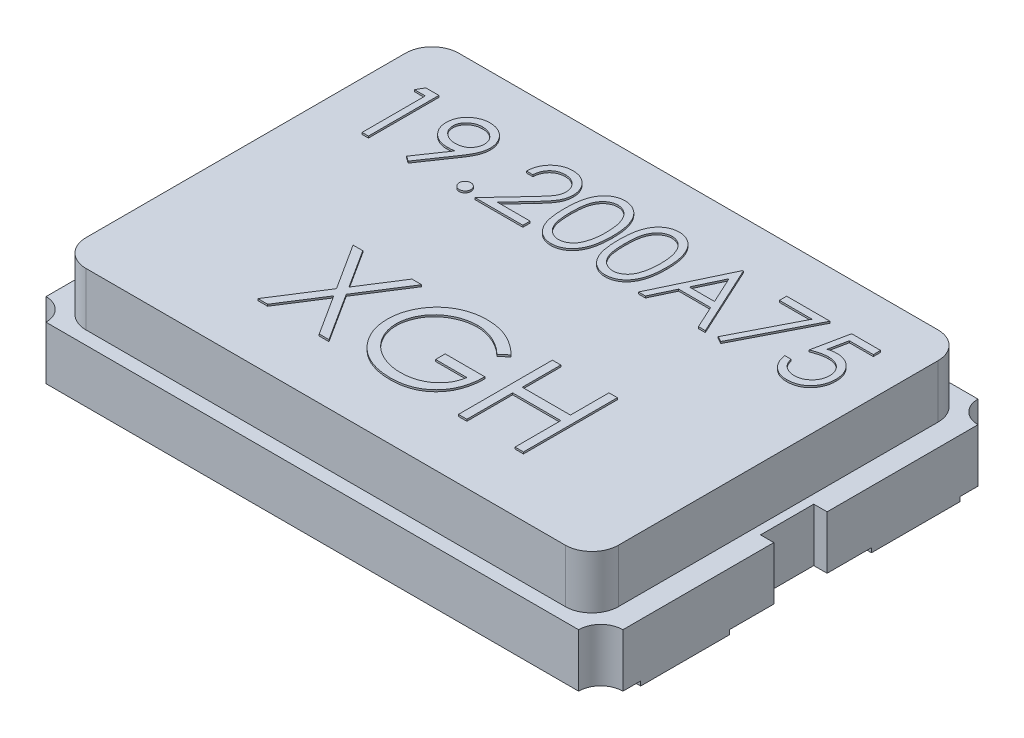
from build123d import *

# Parameters (mm, degrees)
EXTRUDE1_DEPTH = 0.6
EXTRUDE2_DEPTH = 0.6
SKETCH3_W      = 1
SKETCH3_H      = 1
EXTRUDE3_DEPTH = 0.05
EXTRUDE4_DEPTH = 0.02
EXTRUDE5_DEPTH = 0.02


with BuildPart() as part:
    # Sketch1 → Extrude1 (new body)
    with BuildSketch(Plane(origin=(0, 0, 0), x_dir=(1, 0, 0), z_dir=(0, 1, 0))):
        with BuildLine():
            Line((-3.25, 2), (-3.25, 0.3))
            Line((-3.25, 0.3), (-3.1, 0.3))
            Line((-3.1, 0.3), (-3.1, -0.3))
            Line((-3.1, -0.3), (-3.25, -0.3))
            Line((-3.25, -0.3), (-3.25, -2))
            ThreePointArc((-3.25, -2), (-3.073223305, -2.073223305), (-3, -2.25))
            Line((-3, -2.25), (3, -2.25))
            ThreePointArc((3, -2.25), (3.073223305, -2.073223305), (3.25, -2))
            Line((3.25, -2), (3.25, -0.3))
            Line((3.25, -0.3), (3.1, -0.3))
            Line((3.1, -0.3), (3.1, 0.3))
            Line((3.1, 0.3), (3.25, 0.3))
            Line((3.25, 0.3), (3.25, 2))
            ThreePointArc((3.25, 2), (3.073223305, 2.073223305), (3, 2.25))
            Line((3, 2.25), (-3, 2.25))
            ThreePointArc((-3, 2.25), (-3.073223305, 2.073223305), (-3.25, 2))
        make_face()
    extrude(amount=EXTRUDE1_DEPTH)

    # Sketch2 → Extrude2 (add)
    with BuildSketch(Plane(origin=(0, 0.6, 0), x_dir=(1, 0, 0), z_dir=(0, 1, 0))):
        with BuildLine():
            Line((-2.7, 2.1), (2.7, 2.1))
            ThreePointArc((2.7, 2.1), (2.912132034, 2.012132034), (3, 1.8))
            Line((3, 1.8), (3, -1.8))
            ThreePointArc((3, -1.8), (2.912132034, -2.012132034), (2.7, -2.1))
            Line((2.7, -2.1), (-2.7, -2.1))
            ThreePointArc((-2.7, -2.1), (-2.912132034, -2.012132034), (-3, -1.8))
            Line((-3, -1.8), (-3, 1.8))
            ThreePointArc((-3, 1.8), (-2.912132034, 2.012132034), (-2.7, 2.1))
        make_face()
    extrude(amount=EXTRUDE2_DEPTH)

    # Sketch3 → Extrude3 (add)
    with BuildSketch(Plane.XZ):
        with Locations((-2.75, 1.3)):
            Rectangle(SKETCH3_W, SKETCH3_H)
        with Locations((-2.75, -1.3)):
            Rectangle(SKETCH3_W, SKETCH3_H)
        with Locations((2.75, 1.3)):
            Rectangle(SKETCH3_W, SKETCH3_H)
        with Locations((2.75, -1.3)):
            Rectangle(SKETCH3_W, SKETCH3_H)
    extrude(amount=EXTRUDE3_DEPTH)

    # Sketch4 → Extrude4 (add)
    # profile 1 of 9: a face of its own
    with BuildSketch(Plane(origin=(0, 1.2, 0), x_dir=(1, 0, 0), z_dir=(0, 1, 0))):
        Polygon((-2.526616546, 1.555911653), (-2.379855478, 1.555911653), (-2.379855478, 0.762161653), (-2.451089453, 0.762161653), (-2.451089453, 1.474501397), (-2.573204837, 1.474501397), align=None)
    # profile 2 of 9: a face of its own
    with BuildSketch(Plane(origin=(0, 1.2, 0), x_dir=(1, 0, 0), z_dir=(0, 1, 0))):
        with BuildLine():
            Line((-1.911746504, 0.741809089), (-1.968670082, 0.781401186))
            Line((-1.968670082, 0.781401186), (-1.747971965, 1.104021128))
            add(Edge.make_bspline(
                [(-1.747971965, 1.104021128), (-1.762053257, 1.10229913), (-1.789780105, 1.098908419), (-1.817705841, 1.098285517), (-1.831449279, 1.097978961)],
                knots=[0, 0, 0, 0, 1.015715272, 2, 2, 2, 2], degree=3))
            add(Edge.make_bspline(
                [(-1.831449279, 1.097978961), (-1.83978185, 1.098192384), (-1.856137959, 1.098611314), (-1.880184423, 1.101931867), (-1.903290613, 1.107045914), (-1.925395271, 1.11467697), (-1.94658148, 1.124160743), (-1.96680299, 1.135921173), (-1.986032579, 1.149756528), (-2.004063724, 1.165593653), (-2.020462993, 1.18298314), (-2.035073277, 1.20138808), (-2.047215641, 1.221022274), (-2.057302295, 1.241485199), (-2.06495188, 1.263070969), (-2.070522313, 1.285533958), (-2.073951847, 1.309031598), (-2.074359856, 1.32502569), (-2.074567017, 1.333146479)],
                knots=[0, 0, 0, 0, 1.060718605, 2.082097864, 3.085795603, 4.069760067, 5.054557537, 6.03741023, 7.043284206, 8.066802108, 9.088538119, 10.083643548, 11.053783639, 12.022749082, 12.983451788, 13.964007469, 14.966251758, 16, 16, 16, 16], degree=3))
            add(Edge.make_bspline(
                [(-2.074567017, 1.333146479), (-2.074173672, 1.34425187), (-2.073401615, 1.366049499), (-2.067188023, 1.397897872), (-2.056968982, 1.428011963), (-2.042720404, 1.456312596), (-2.024773779, 1.482392668), (-2.00320451, 1.50588962), (-1.978143789, 1.526469256), (-1.95016251, 1.544159467), (-1.91991995, 1.558386868), (-1.888245093, 1.568873281), (-1.855380641, 1.575041568), (-1.833117616, 1.57585479), (-1.821909014, 1.576264217)],
                knots=[0, 0, 0, 0, 1.022988612, 2.007919123, 2.978103895, 3.94594894, 4.918897164, 5.887013414, 6.875921846, 7.89917871, 8.930658928, 9.948724884, 10.967259574, 12, 12, 12, 12], degree=3))
            add(Edge.make_bspline(
                [(-1.821909014, 1.576264217), (-1.810912533, 1.575849163), (-1.789184524, 1.575029053), (-1.75723291, 1.569022867), (-1.726630215, 1.558899908), (-1.697546084, 1.54491073), (-1.670617681, 1.527375453), (-1.646402453, 1.506480659), (-1.625453, 1.482213334), (-1.607803656, 1.455160408), (-1.593636343, 1.426093968), (-1.583414593, 1.395753686), (-1.577122279, 1.364357761), (-1.576329362, 1.343086515), (-1.575929196, 1.332351457)],
                knots=[0, 0, 0, 0, 1.026385292, 2.028040595, 3.023318987, 4.028184125, 5.03290303, 6.015178782, 7.004435299, 8.016004309, 9.023023918, 10.015172535, 10.998308025, 12, 12, 12, 12], degree=3))
            add(Edge.make_bspline(
                [(-1.575929196, 1.332351457), (-1.576196443, 1.324018495), (-1.576738485, 1.307117167), (-1.58053404, 1.281438143), (-1.586979332, 1.255255454), (-1.594293557, 1.233093592), (-1.601353888, 1.214790068), (-1.607998966, 1.200332121), (-1.615372258, 1.185114513), (-1.623971692, 1.169296813), (-1.633215999, 1.152677381), (-1.643661585, 1.135422908), (-1.65507017, 1.11751024), (-1.663195838, 1.105434561), (-1.66735673, 1.099250996)],
                knots=[0, 0, 0, 0, 1.179839688, 2.393009684, 3.667231171, 4.993948276, 5.694988576, 6.444077775, 7.246288328, 8.089075292, 8.993003841, 9.939041771, 10.944649915, 12, 12, 12, 12], degree=3))
            Line((-1.66735673, 1.099250996), (-1.911746504, 0.741809089))
        make_face()
        with BuildLine():
            add(Edge.make_bspline(
                [(-1.818251913, 1.179389217), (-1.811939556, 1.179561662), (-1.799651543, 1.179897352), (-1.781649906, 1.181940519), (-1.764658167, 1.185563191), (-1.748630937, 1.190761054), (-1.733407515, 1.197033192), (-1.719229705, 1.205018767), (-1.706085641, 1.21454754), (-1.693887308, 1.225254097), (-1.683055115, 1.23714914), (-1.673406963, 1.249599019), (-1.665206263, 1.262658386), (-1.65872852, 1.276490787), (-1.653402554, 1.290759511), (-1.64972454, 1.305694338), (-1.647687022, 1.321217457), (-1.647339683, 1.331762689), (-1.647163171, 1.337121589)],
                knots=[0, 0, 0, 0, 1.163407946, 2.26475976, 3.333800367, 4.359385343, 5.366239384, 6.363380779, 7.350133999, 8.353570782, 9.349036268, 10.310270964, 11.253520213, 12.184142, 13.120487599, 14.056272588, 15.012232024, 16, 16, 16, 16], degree=3))
            add(Edge.make_bspline(
                [(-1.647163171, 1.337121589), (-1.647315042, 1.342482727), (-1.647614323, 1.353047508), (-1.650015372, 1.36859361), (-1.654239306, 1.383491903), (-1.659906791, 1.397823951), (-1.667372631, 1.411471999), (-1.676331457, 1.424607399), (-1.686975066, 1.437146863), (-1.699222077, 1.448795481), (-1.712428841, 1.459533308), (-1.726503276, 1.469009793), (-1.741329373, 1.4769521), (-1.756816681, 1.483505974), (-1.772997467, 1.488620394), (-1.789862157, 1.492298261), (-1.807495973, 1.494332927), (-1.819466014, 1.494678071), (-1.825566116, 1.494853961)],
                knots=[0, 0, 0, 0, 0.972161553, 1.915763587, 2.844109794, 3.775983486, 4.705125789, 5.659731448, 6.655561913, 7.682237399, 8.721216875, 9.739758359, 10.754845918, 11.767244016, 12.7857855, 13.828538656, 14.893392813, 16, 16, 16, 16], degree=3))
            add(Edge.make_bspline(
                [(-1.825566116, 1.494853961), (-1.831613165, 1.494677787), (-1.843477425, 1.494332134), (-1.860954475, 1.492302129), (-1.877705133, 1.48859566), (-1.893839036, 1.483508343), (-1.909325884, 1.476951611), (-1.924151281, 1.469009377), (-1.938229008, 1.45953549), (-1.951423111, 1.448787032), (-1.963691747, 1.437201084), (-1.974152358, 1.424552467), (-1.983131687, 1.411478832), (-1.990587268, 1.397822135), (-1.996257482, 1.383492388), (-2.000480686, 1.368593479), (-2.002881931, 1.353047542), (-2.003181185, 1.342482739), (-2.003333043, 1.337121589)],
                knots=[0, 0, 0, 0, 1.099389452, 2.15699305, 3.192601482, 4.213358962, 5.227959689, 6.245255729, 7.266013209, 8.307253147, 9.336162325, 10.327954924, 11.284637477, 12.215801273, 13.149702402, 14.080068371, 15.025723358, 16, 16, 16, 16], degree=3))
            add(Edge.make_bspline(
                [(-2.003333043, 1.337121589), (-2.003195627, 1.331758515), (-2.002924619, 1.321181553), (-2.000310281, 1.305640746), (-1.995938242, 1.290743602), (-1.990082773, 1.27634527), (-1.982371699, 1.262585759), (-1.972909326, 1.249530304), (-1.961818247, 1.237030907), (-1.949246724, 1.225281772), (-1.935488051, 1.214497618), (-1.920793075, 1.20507912), (-1.905414773, 1.197125191), (-1.88929901, 1.190743127), (-1.872565218, 1.185615125), (-1.855063001, 1.181947196), (-1.83685024, 1.17991695), (-1.824510833, 1.179566816), (-1.818251913, 1.179389217)],
                knots=[0, 0, 0, 0, 0.952633368, 1.87876736, 2.791047057, 3.707742249, 4.635551637, 5.587206343, 6.568248508, 7.601284464, 8.641511608, 9.671105535, 10.699146789, 11.713763218, 12.747829548, 13.806491675, 14.887386225, 16, 16, 16, 16], degree=3))
        make_face(mode=Mode.SUBTRACT)
    # profile 3 of 9: a face of its own
    with BuildSketch(Plane(origin=(0, 1.2, 0), x_dir=(1, 0, 0), z_dir=(0, 1, 0))):
        with BuildLine():
            add(Edge.make_bspline(
                [(-1.34696285, 0.884277038), (-1.342542749, 0.884014382), (-1.333877656, 0.883499476), (-1.321350211, 0.879966909), (-1.310012136, 0.87369432), (-1.299912859, 0.865334369), (-1.291588355, 0.855198031), (-1.285092225, 0.843950387), (-1.28159043, 0.831318062), (-1.281079275, 0.822602761), (-1.280817017, 0.818131205)],
                knots=[0, 0, 0, 0, 1.020151414, 1.999887582, 2.974338812, 3.990962822, 5.007586832, 5.987933904, 6.967670073, 8, 8, 8, 8], degree=3))
            add(Edge.make_bspline(
                [(-1.280817017, 0.818131205), (-1.281088162, 0.813767092), (-1.281622856, 0.805161127), (-1.285084198, 0.792624081), (-1.291637863, 0.781369408), (-1.299855442, 0.77109553), (-1.310014633, 0.762717868), (-1.321377016, 0.756498646), (-1.333848248, 0.752713143), (-1.342537842, 0.752230929), (-1.34696285, 0.751985371)],
                knots=[0, 0, 0, 0, 1.009421747, 1.99056486, 2.972319754, 3.999869655, 5.017953583, 5.993804169, 6.978383603, 8, 8, 8, 8], degree=3))
            add(Edge.make_bspline(
                [(-1.34696285, 0.751985371), (-1.351391047, 0.752222044), (-1.360036046, 0.752684092), (-1.372460727, 0.756576371), (-1.383892307, 0.762659549), (-1.394049521, 0.771111151), (-1.402335924, 0.781316541), (-1.408600966, 0.792701591), (-1.412363375, 0.805125239), (-1.412858192, 0.813760024), (-1.413108684, 0.818131205)],
                knots=[0, 0, 0, 0, 1.022052826, 1.995314843, 2.982371812, 4.00089066, 5.028879526, 6.005146991, 6.990147033, 8, 8, 8, 8], degree=3))
            add(Edge.make_bspline(
                [(-1.413108684, 0.818131205), (-1.412867815, 0.822610082), (-1.412397548, 0.83135454), (-1.408593068, 0.843872909), (-1.402384534, 0.855250394), (-1.393992239, 0.865318904), (-1.383894765, 0.873752453), (-1.372488304, 0.879890362), (-1.360006122, 0.883528098), (-1.351386011, 0.884023062), (-1.34696285, 0.884277038)],
                knots=[0, 0, 0, 0, 1.032775665, 2.016367738, 2.991239715, 4.008302682, 5.025365648, 6.011011707, 6.979408107, 8, 8, 8, 8], degree=3))
        make_face()
    # profile 4 of 9: a face of its own
    with BuildSketch(Plane(origin=(0, 1.2, 0), x_dir=(1, 0, 0), z_dir=(0, 1, 0))):
        with BuildLine():
            Line((-1.077291376, 1.311680884), (-1.14852535, 1.311680884))
            add(Edge.make_bspline(
                [(-1.14852535, 1.311680884), (-1.148061085, 1.321131246), (-1.147149281, 1.339691506), (-1.142879294, 1.366752463), (-1.136769488, 1.392618462), (-1.12813089, 1.417081817), (-1.117402502, 1.440358833), (-1.104536943, 1.46235705), (-1.089298337, 1.482992552), (-1.072015739, 1.50207404), (-1.053244994, 1.519579078), (-1.032991682, 1.534695535), (-1.011708971, 1.547467578), (-0.989461429, 1.558144932), (-0.965998051, 1.566159504), (-0.94153176, 1.572106197), (-0.915955063, 1.575684047), (-0.898528843, 1.576068627), (-0.889666176, 1.576264217)],
                knots=[0, 0, 0, 0, 1.10065271, 2.161652631, 3.183658789, 4.190468796, 5.17591951, 6.163126047, 7.15150782, 8.156236427, 9.156009102, 10.134482811, 11.092018607, 12.041330605, 13.001268258, 13.972401359, 14.968799086, 16, 16, 16, 16], degree=3))
            add(Edge.make_bspline(
                [(-0.889666176, 1.576264217), (-0.880962577, 1.57606046), (-0.863860316, 1.575660085), (-0.838899823, 1.57222178), (-0.81513783, 1.566836619), (-0.792620782, 1.559281159), (-0.771528336, 1.54912469), (-0.751702038, 1.536924177), (-0.732905854, 1.522813608), (-0.715986101, 1.50620069), (-0.700449448, 1.488465506), (-0.687045901, 1.469531642), (-0.675567558, 1.449976072), (-0.665999995, 1.429649676), (-0.658956906, 1.408361068), (-0.653609706, 1.386420185), (-0.650587239, 1.363599915), (-0.650123366, 1.348154321), (-0.64988753, 1.340301677)],
                knots=[0, 0, 0, 0, 1.111607364, 2.184268762, 3.212621178, 4.221274766, 5.211760367, 6.196651075, 7.1921475, 8.207485113, 9.220403448, 10.201281604, 11.166441695, 12.114753415, 13.065576456, 14.026450734, 14.996634279, 16, 16, 16, 16], degree=3))
            add(Edge.make_bspline(
                [(-0.64988753, 1.340301677), (-0.650271538, 1.329246365), (-0.651032814, 1.307329745), (-0.657544825, 1.275122803), (-0.667715373, 1.243918581), (-0.679961202, 1.218804943), (-0.692314774, 1.198568061), (-0.70344712, 1.181906408), (-0.716479318, 1.163966418), (-0.731601049, 1.144808165), (-0.748499504, 1.124281585), (-0.767327744, 1.102399078), (-0.788220034, 1.07938673), (-0.802883658, 1.06366921), (-0.810481981, 1.055524784)],
                knots=[0, 0, 0, 0, 1.184426356, 2.348067706, 3.509069118, 4.696110526, 5.333549288, 6.050745305, 6.844228056, 7.710549037, 8.667450064, 9.695053472, 10.805634456, 12, 12, 12, 12], degree=3))
            Line((-0.810481981, 1.055524784), (-1.009078485, 0.84357191))
            Line((-1.009078485, 0.84357191), (-0.639711248, 0.84357191))
            Line((-0.639711248, 0.84357191), (-0.639711248, 0.762161653))
            Line((-0.639711248, 0.762161653), (-1.179054196, 0.762161653))
            Line((-1.179054196, 0.762161653), (-0.871221664, 1.090664758))
            add(Edge.make_bspline(
                [(-0.871221664, 1.090664758), (-0.863726876, 1.098488481), (-0.849330921, 1.113516252), (-0.828969515, 1.135456174), (-0.810681744, 1.155810087), (-0.794349228, 1.174539537), (-0.780326273, 1.191918481), (-0.767882034, 1.207384066), (-0.757911267, 1.221615879), (-0.747090096, 1.238112411), (-0.736609426, 1.258253776), (-0.727603231, 1.282867666), (-0.722111649, 1.308205811), (-0.721452874, 1.325328594), (-0.721121504, 1.333941501)],
                knots=[0, 0, 0, 0, 1.329631726, 2.553950428, 3.673215718, 4.687767853, 5.603093632, 6.413772471, 7.123043292, 7.734684054, 8.834405432, 9.900288307, 10.943827018, 12, 12, 12, 12], degree=3))
            add(Edge.make_bspline(
                [(-0.721121504, 1.333941501), (-0.721265681, 1.339357461), (-0.721549827, 1.350031278), (-0.724057555, 1.365680798), (-0.727847259, 1.380776747), (-0.733277701, 1.395365559), (-0.740445659, 1.409300555), (-0.749170872, 1.422598698), (-0.759237904, 1.435454946), (-0.770883638, 1.447509354), (-0.783676965, 1.458549556), (-0.797192089, 1.468329483), (-0.811490952, 1.476502638), (-0.826513266, 1.483202681), (-0.842217149, 1.488458527), (-0.858632975, 1.492100383), (-0.875715386, 1.494386946), (-0.887379768, 1.494696321), (-0.893323277, 1.494853961)],
                knots=[0, 0, 0, 0, 0.991446411, 1.95395049, 2.89581595, 3.838931463, 4.798493298, 5.75982156, 6.748411868, 7.785213223, 8.824556874, 9.840280684, 10.836137867, 11.835679398, 12.848801643, 13.863922112, 14.911575587, 16, 16, 16, 16], degree=3))
            add(Edge.make_bspline(
                [(-0.893323277, 1.494853961), (-0.899530591, 1.494691802), (-0.91172073, 1.494373348), (-0.92961844, 1.492145708), (-0.946692178, 1.488302634), (-0.962984896, 1.483046495), (-0.978524159, 1.476365717), (-0.993234397, 1.468044554), (-1.007082588, 1.458115083), (-1.020094764, 1.446857314), (-1.032083559, 1.434323411), (-1.042617047, 1.420351152), (-1.051820922, 1.405195649), (-1.05985123, 1.388897795), (-1.06637261, 1.371309706), (-1.071355807, 1.352493816), (-1.075298895, 1.332531824), (-1.076616185, 1.318746635), (-1.077291376, 1.311680884)],
                knots=[0, 0, 0, 0, 1.031018746, 2.02475058, 2.990194455, 3.934040569, 4.864654155, 5.795059489, 6.735614925, 7.690564532, 8.649604399, 9.611025574, 10.590972636, 11.591080095, 12.624614302, 13.701020113, 14.821632451, 16, 16, 16, 16], degree=3))
        make_face()
    # profile 5 of 9: a face of its own
    with BuildSketch(Plane(origin=(0, 1.2, 0), x_dir=(1, 0, 0), z_dir=(0, 1, 0))):
        with BuildLine():
            add(Edge.make_bspline(
                [(-0.568477273, 1.158718644), (-0.568402884, 1.171440731), (-0.56825838, 1.196153566), (-0.566650828, 1.232163655), (-0.563980348, 1.26594572), (-0.560320623, 1.29750138), (-0.555867009, 1.32683878), (-0.549921711, 1.35387952), (-0.543160594, 1.378748752), (-0.535324592, 1.401527574), (-0.526482719, 1.422522874), (-0.516859235, 1.442122875), (-0.506072219, 1.46029792), (-0.494738169, 1.477338098), (-0.482398288, 1.492964472), (-0.469403741, 1.507397718), (-0.455247352, 1.520304263), (-0.440410348, 1.532062264), (-0.4247584, 1.542369555), (-0.408737652, 1.551448408), (-0.392237834, 1.55920445), (-0.375213896, 1.565302816), (-0.357818851, 1.570339919), (-0.339991892, 1.573784555), (-0.321703582, 1.575951926), (-0.30935931, 1.576159133), (-0.303098918, 1.576264217)],
                knots=[0, 0, 0, 0, 1.646270934, 3.197905019, 4.663502075, 6.030701355, 7.308322542, 8.50163776, 9.611534131, 10.641858119, 11.616356847, 12.558055219, 13.465016945, 14.349605745, 15.204443733, 16.039544428, 16.859896111, 17.680448484, 18.487036065, 19.28249412, 20.06191084, 20.843045899, 21.620316918, 22.403196591, 23.190181807, 24, 24, 24, 24], degree=3))
            add(Edge.make_bspline(
                [(-0.303098918, 1.576264217), (-0.296786229, 1.576153588), (-0.284232277, 1.575933581), (-0.265672049, 1.573819044), (-0.247540603, 1.570310414), (-0.22991524, 1.56533905), (-0.21265118, 1.559171459), (-0.195883459, 1.551440988), (-0.179507925, 1.542442388), (-0.163784806, 1.531868758), (-0.148541492, 1.520079921), (-0.1341524, 1.506753387), (-0.120616221, 1.492023718), (-0.107763072, 1.47604851), (-0.095957606, 1.458521357), (-0.08471506, 1.439747103), (-0.074652116, 1.419397425), (-0.064960502, 1.397811855), (-0.056595061, 1.374393132), (-0.049050751, 1.349273267), (-0.042954985, 1.322155549), (-0.037877418, 1.293182258), (-0.033943844, 1.262246989), (-0.031078941, 1.229416057), (-0.02956558, 1.194667861), (-0.029280579, 1.170910278), (-0.029134325, 1.158718644)],
                knots=[0, 0, 0, 0, 0.810914788, 1.612654377, 2.396697861, 3.181598691, 3.963628158, 4.749916497, 5.551656086, 6.361998678, 7.18212741, 8.025565596, 8.878627764, 9.750805457, 10.657531673, 11.591944965, 12.560506719, 13.57287815, 14.630710178, 15.753379473, 16.941251878, 18.199788006, 19.531962791, 20.947069417, 22.433333509, 24, 24, 24, 24], degree=3))
            add(Edge.make_bspline(
                [(-0.029134325, 1.158718644), (-0.029282095, 1.146580187), (-0.029570019, 1.122928897), (-0.031061975, 1.088337051), (-0.034000808, 1.055680352), (-0.037677002, 1.024880479), (-0.042768559, 0.996065626), (-0.049029017, 0.969136081), (-0.055980072, 0.943975551), (-0.064560463, 0.920790156), (-0.07395182, 0.899256462), (-0.084169695, 0.879148019), (-0.095116602, 0.860287092), (-0.107042978, 0.84282465), (-0.119755092, 0.82663699), (-0.133525019, 0.81200985), (-0.147964598, 0.798590787), (-0.163252771, 0.78665015), (-0.179221105, 0.776198775), (-0.195540395, 0.766852063), (-0.212500198, 0.759315362), (-0.229716171, 0.752844022), (-0.247434569, 0.747899991), (-0.265633304, 0.744481456), (-0.284219807, 0.742083912), (-0.296784091, 0.741901014), (-0.303098918, 0.741809089)],
                knots=[0, 0, 0, 0, 1.561518951, 3.042555995, 4.452378317, 5.7783523, 7.031515105, 8.214008947, 9.334062868, 10.386615937, 11.391082383, 12.354592575, 13.286541444, 14.194233754, 15.072674879, 15.931287219, 16.775624067, 17.606195743, 18.42308326, 19.229000347, 20.022332153, 20.807536673, 21.593273796, 22.3848459, 23.188221202, 24, 24, 24, 24], degree=3))
            add(Edge.make_bspline(
                [(-0.303098918, 0.741809089), (-0.309359137, 0.741914852), (-0.321703066, 0.742123395), (-0.339993884, 0.744280974), (-0.357747224, 0.747749775), (-0.375050691, 0.752606755), (-0.391993062, 0.758551906), (-0.40834347, 0.766297473), (-0.424283712, 0.775217878), (-0.439771261, 0.78537684), (-0.454515091, 0.797015864), (-0.468598167, 0.809889194), (-0.481666698, 0.824318075), (-0.493830145, 0.840074675), (-0.50539034, 0.857014036), (-0.51602418, 0.875367434), (-0.52586007, 0.895062098), (-0.534850648, 0.916225267), (-0.542821862, 0.93916576), (-0.549863039, 0.96414602), (-0.5554225, 0.99138653), (-0.560181134, 1.020668504), (-0.564019343, 1.052117771), (-0.566639698, 1.085751402), (-0.568259247, 1.121548441), (-0.568403272, 1.146102479), (-0.568477273, 1.158718644)],
                knots=[0, 0, 0, 0, 0.810891512, 1.598919785, 2.382837074, 3.152667961, 3.926044502, 4.706494248, 5.493654104, 6.291793342, 7.103789334, 7.925228297, 8.761435821, 9.622817696, 10.50288917, 11.416980706, 12.369136599, 13.353924996, 14.394355917, 15.514179734, 16.714354668, 17.994756427, 19.357759367, 20.818452758, 22.365282078, 24, 24, 24, 24], degree=3))
        make_face()
        with BuildLine():
            add(Edge.make_bspline(
                [(-0.497243299, 1.159036653), (-0.49721621, 1.148434716), (-0.497163636, 1.127858438), (-0.495790176, 1.09795827), (-0.493919141, 1.070070356), (-0.491505847, 1.044159286), (-0.487921964, 1.020312766), (-0.483906318, 0.998366784), (-0.479019519, 0.978437482), (-0.473237613, 0.960388103), (-0.466651961, 0.943912333), (-0.459461524, 0.928581343), (-0.451737038, 0.914214029), (-0.44309216, 0.900939442), (-0.433677136, 0.888714294), (-0.423704629, 0.877322206), (-0.412802454, 0.86716289), (-0.397720355, 0.854978407), (-0.377809369, 0.842387461), (-0.35272223, 0.831423258), (-0.326943849, 0.824532951), (-0.309447048, 0.823656706), (-0.300713852, 0.823219346)],
                knots=[0, 0, 0, 0, 1.459021318, 2.831673884, 4.118529203, 5.306027144, 6.411944654, 7.436330062, 8.375795394, 9.233974572, 10.042671642, 10.816086306, 11.563610507, 12.285937304, 12.993564865, 13.685989202, 14.367179055, 15.041617293, 16.353048772, 17.594441528, 18.799311195, 20, 20, 20, 20], degree=3))
            add(Edge.make_bspline(
                [(-0.300713852, 0.823219346), (-0.291924166, 0.823581699), (-0.274362941, 0.824305659), (-0.248705812, 0.831290373), (-0.223797876, 0.841829), (-0.204277989, 0.85429031), (-0.189427484, 0.866157627), (-0.178787381, 0.876275592), (-0.169021523, 0.887604869), (-0.159759124, 0.899828459), (-0.151263941, 0.913179898), (-0.143538908, 0.927594982), (-0.136489649, 0.943113742), (-0.13247349, 0.953947236), (-0.130420132, 0.959486122)],
                knots=[0, 0, 0, 0, 1.353760809, 2.704726607, 4.075137775, 5.516104923, 6.260822281, 7.007110065, 7.778089737, 8.566572457, 9.372053459, 10.217411131, 11.088608312, 12, 12, 12, 12], degree=3))
            add(Edge.make_bspline(
                [(-0.130420132, 0.959486122), (-0.128027142, 0.966568581), (-0.123168345, 0.98094901), (-0.116906389, 1.003256481), (-0.111974844, 1.026661393), (-0.107538152, 1.051023875), (-0.104509869, 1.076523593), (-0.102072419, 1.103081648), (-0.100636709, 1.130718064), (-0.100458739, 1.149494785), (-0.100368299, 1.159036653)],
                knots=[0, 0, 0, 0, 0.884706709, 1.796334032, 2.740027952, 3.714592787, 4.726048262, 5.777819803, 6.87074269, 8, 8, 8, 8], degree=3))
            add(Edge.make_bspline(
                [(-0.100368299, 1.159036653), (-0.100493074, 1.168576978), (-0.100737161, 1.187239892), (-0.101670154, 1.214571694), (-0.104079429, 1.240531346), (-0.106755301, 1.265230686), (-0.110700742, 1.288532987), (-0.114954745, 1.310633324), (-0.12067002, 1.331257903), (-0.12677504, 1.350729629), (-0.133762398, 1.368827278), (-0.141454002, 1.385635226), (-0.149668579, 1.401234618), (-0.158590837, 1.415582657), (-0.168114858, 1.428743609), (-0.178492017, 1.440453597), (-0.189310687, 1.451075552), (-0.20446387, 1.463200099), (-0.224301789, 1.475562573), (-0.248986427, 1.486939451), (-0.274674591, 1.49347276), (-0.292040357, 1.494393893), (-0.300713852, 1.494853961)],
                knots=[0, 0, 0, 0, 1.31362396, 2.569729283, 3.763502607, 4.902122613, 5.988968491, 7.01645872, 7.998833611, 8.933434873, 9.825090667, 10.667526885, 11.477055099, 12.250526234, 12.991942729, 13.710640831, 14.402115721, 15.076753259, 16.378508321, 17.609869233, 18.806226677, 20, 20, 20, 20], degree=3))
            add(Edge.make_bspline(
                [(-0.300713852, 1.494853961), (-0.309492861, 1.494393258), (-0.327066873, 1.493471012), (-0.353022034, 1.486963792), (-0.377901414, 1.475621566), (-0.397686874, 1.463159153), (-0.412850626, 1.451289572), (-0.423528308, 1.440996572), (-0.433540029, 1.429737511), (-0.442762883, 1.417399934), (-0.451400988, 1.404140824), (-0.459334182, 1.389855872), (-0.466481862, 1.374472688), (-0.473077819, 1.358004317), (-0.478877362, 1.339956496), (-0.483661172, 1.320051742), (-0.488080557, 1.298175563), (-0.491209127, 1.274199889), (-0.493990372, 1.248282329), (-0.495777749, 1.220324795), (-0.49716823, 1.19037448), (-0.497217775, 1.169691813), (-0.497243299, 1.159036653)],
                knots=[0, 0, 0, 0, 1.207732386, 2.417664972, 3.655092373, 4.956220595, 5.625982001, 6.301752483, 6.994047911, 7.697131622, 8.419323945, 9.170223765, 9.943494443, 10.752040957, 11.610060368, 12.549350801, 13.567764191, 14.679664412, 15.874934091, 17.154273443, 18.533957287, 20, 20, 20, 20], degree=3))
        make_face(mode=Mode.SUBTRACT)
    # profile 6 of 9: a face of its own
    with BuildSketch(Plane(origin=(0, 1.2, 0), x_dir=(1, 0, 0), z_dir=(0, 1, 0))):
        with BuildLine():
            add(Edge.make_bspline(
                [(0.04209965, 1.158718644), (0.04217404, 1.171440731), (0.042318543, 1.196153566), (0.043926095, 1.232163655), (0.046596575, 1.26594572), (0.050256301, 1.29750138), (0.054709914, 1.32683878), (0.060655212, 1.35387952), (0.067416329, 1.378748752), (0.075252331, 1.401527574), (0.084094204, 1.422522874), (0.093717688, 1.442122875), (0.104504704, 1.46029792), (0.115838754, 1.477338098), (0.128178635, 1.492964472), (0.141173182, 1.507397718), (0.155329572, 1.520304263), (0.170166575, 1.532062264), (0.185818523, 1.542369555), (0.201839271, 1.551448408), (0.21833909, 1.55920445), (0.235363027, 1.565302816), (0.252758072, 1.570339919), (0.270585032, 1.573784555), (0.288873341, 1.575951926), (0.301217613, 1.576159133), (0.307478005, 1.576264217)],
                knots=[0, 0, 0, 0, 1.646270934, 3.197905019, 4.663502075, 6.030701355, 7.308322542, 8.50163776, 9.611534131, 10.641858119, 11.616356847, 12.558055219, 13.465016945, 14.349605745, 15.204443733, 16.039544428, 16.859896111, 17.680448484, 18.487036065, 19.28249412, 20.06191084, 20.843045899, 21.620316918, 22.403196591, 23.190181807, 24, 24, 24, 24], degree=3))
            add(Edge.make_bspline(
                [(0.307478005, 1.576264217), (0.313790694, 1.576153588), (0.326344646, 1.575933581), (0.344904874, 1.573819044), (0.36303632, 1.570310414), (0.380661683, 1.56533905), (0.397925743, 1.559171459), (0.414693464, 1.551440988), (0.431068998, 1.542442388), (0.446792117, 1.531868758), (0.462035432, 1.520079921), (0.476424523, 1.506753387), (0.489960702, 1.492023718), (0.502813851, 1.47604851), (0.514619317, 1.458521357), (0.525861863, 1.439747103), (0.535924807, 1.419397425), (0.545616421, 1.397811855), (0.553981863, 1.374393132), (0.561526172, 1.349273267), (0.567621938, 1.322155549), (0.572699505, 1.293182258), (0.57663308, 1.262246989), (0.579497982, 1.229416057), (0.581011343, 1.194667861), (0.581296345, 1.170910278), (0.581442598, 1.158718644)],
                knots=[0, 0, 0, 0, 0.810914788, 1.612654377, 2.396697861, 3.181598691, 3.963628158, 4.749916497, 5.551656086, 6.361998678, 7.18212741, 8.025565596, 8.878627764, 9.750805457, 10.657531673, 11.591944965, 12.560506719, 13.57287815, 14.630710178, 15.753379473, 16.941251878, 18.199788006, 19.531962791, 20.947069417, 22.433333509, 24, 24, 24, 24], degree=3))
            add(Edge.make_bspline(
                [(0.581442598, 1.158718644), (0.581294828, 1.146580187), (0.581006904, 1.122928897), (0.579514948, 1.088337051), (0.576576115, 1.055680352), (0.572899922, 1.024880479), (0.567808364, 0.996065626), (0.561547906, 0.969136081), (0.554596851, 0.943975551), (0.54601646, 0.920790156), (0.536625103, 0.899256462), (0.526407228, 0.879148019), (0.515460321, 0.860287092), (0.503533945, 0.84282465), (0.490821832, 0.82663699), (0.477051904, 0.81200985), (0.462612325, 0.798590787), (0.447324152, 0.78665015), (0.431355818, 0.776198775), (0.415036528, 0.766852063), (0.398076725, 0.759315362), (0.380860752, 0.752844022), (0.363142354, 0.747899991), (0.344943619, 0.744481456), (0.326357116, 0.742083912), (0.313792832, 0.741901014), (0.307478005, 0.741809089)],
                knots=[0, 0, 0, 0, 1.561518951, 3.042555995, 4.452378317, 5.7783523, 7.031515105, 8.214008947, 9.334062868, 10.386615937, 11.391082383, 12.354592575, 13.286541444, 14.194233754, 15.072674879, 15.931287219, 16.775624067, 17.606195743, 18.42308326, 19.229000347, 20.022332153, 20.807536673, 21.593273796, 22.3848459, 23.188221202, 24, 24, 24, 24], degree=3))
            add(Edge.make_bspline(
                [(0.307478005, 0.741809089), (0.301217786, 0.741914852), (0.288873857, 0.742123395), (0.270583039, 0.744280974), (0.252829699, 0.747749775), (0.235526232, 0.752606755), (0.218583861, 0.758551906), (0.202233454, 0.766297473), (0.186293211, 0.775217878), (0.170805662, 0.78537684), (0.156061832, 0.797015864), (0.141978756, 0.809889194), (0.128910225, 0.824318075), (0.116746778, 0.840074675), (0.105186583, 0.857014036), (0.094552743, 0.875367434), (0.084716853, 0.895062098), (0.075726275, 0.916225267), (0.067755061, 0.93916576), (0.060713884, 0.96414602), (0.055154423, 0.99138653), (0.050395789, 1.020668504), (0.046557581, 1.052117771), (0.043937225, 1.085751402), (0.042317676, 1.121548441), (0.042173651, 1.146102479), (0.04209965, 1.158718644)],
                knots=[0, 0, 0, 0, 0.810891512, 1.598919785, 2.382837074, 3.152667961, 3.926044502, 4.706494248, 5.493654104, 6.291793342, 7.103789334, 7.925228297, 8.761435821, 9.622817696, 10.50288917, 11.416980706, 12.369136599, 13.353924996, 14.394355917, 15.514179734, 16.714354668, 17.994756427, 19.357759367, 20.818452758, 22.365282078, 24, 24, 24, 24], degree=3))
        make_face()
        with BuildLine():
            add(Edge.make_bspline(
                [(0.113333624, 1.159036653), (0.113360713, 1.148434716), (0.113413287, 1.127858438), (0.114786747, 1.09795827), (0.116657782, 1.070070356), (0.119071076, 1.044159286), (0.122654959, 1.020312766), (0.126670605, 0.998366784), (0.131557404, 0.978437482), (0.13733931, 0.960388103), (0.143924962, 0.943912333), (0.151115399, 0.928581343), (0.158839885, 0.914214029), (0.167484764, 0.900939442), (0.176899787, 0.888714294), (0.186872294, 0.877322206), (0.197774469, 0.86716289), (0.212856568, 0.854978407), (0.232767554, 0.842387461), (0.257854693, 0.831423258), (0.283633074, 0.824532951), (0.301129875, 0.823656706), (0.309863071, 0.823219346)],
                knots=[0, 0, 0, 0, 1.459021318, 2.831673884, 4.118529203, 5.306027144, 6.411944654, 7.436330062, 8.375795394, 9.233974572, 10.042671642, 10.816086306, 11.563610507, 12.285937304, 12.993564865, 13.685989202, 14.367179055, 15.041617293, 16.353048772, 17.594441528, 18.799311195, 20, 20, 20, 20], degree=3))
            add(Edge.make_bspline(
                [(0.309863071, 0.823219346), (0.318652757, 0.823581699), (0.336213983, 0.824305659), (0.361871111, 0.831290373), (0.386779047, 0.841829), (0.406298934, 0.85429031), (0.421149439, 0.866157627), (0.431789542, 0.876275592), (0.4415554, 0.887604869), (0.450817799, 0.899828459), (0.459312982, 0.913179898), (0.467038015, 0.927594982), (0.474087274, 0.943113742), (0.478103433, 0.953947236), (0.480156791, 0.959486122)],
                knots=[0, 0, 0, 0, 1.353760809, 2.704726607, 4.075137775, 5.516104923, 6.260822281, 7.007110065, 7.778089737, 8.566572457, 9.372053459, 10.217411131, 11.088608312, 12, 12, 12, 12], degree=3))
            add(Edge.make_bspline(
                [(0.480156791, 0.959486122), (0.482549781, 0.966568581), (0.487408578, 0.98094901), (0.493670534, 1.003256481), (0.49860208, 1.026661393), (0.503038771, 1.051023875), (0.506067054, 1.076523593), (0.508504504, 1.103081648), (0.509940214, 1.130718064), (0.510118184, 1.149494785), (0.510208624, 1.159036653)],
                knots=[0, 0, 0, 0, 0.884706709, 1.796334032, 2.740027952, 3.714592787, 4.726048262, 5.777819803, 6.87074269, 8, 8, 8, 8], degree=3))
            add(Edge.make_bspline(
                [(0.510208624, 1.159036653), (0.510083849, 1.168576978), (0.509839762, 1.187239892), (0.508906769, 1.214571694), (0.506497494, 1.240531346), (0.503821622, 1.265230686), (0.499876181, 1.288532987), (0.495622178, 1.310633324), (0.489906903, 1.331257903), (0.483801883, 1.350729629), (0.476814525, 1.368827278), (0.469122921, 1.385635226), (0.460908344, 1.401234618), (0.451986086, 1.415582657), (0.442462065, 1.428743609), (0.432084906, 1.440453597), (0.421266236, 1.451075552), (0.406113053, 1.463200099), (0.386275134, 1.475562573), (0.361590496, 1.486939451), (0.335902332, 1.49347276), (0.318536566, 1.494393893), (0.309863071, 1.494853961)],
                knots=[0, 0, 0, 0, 1.31362396, 2.569729283, 3.763502607, 4.902122613, 5.988968491, 7.01645872, 7.998833611, 8.933434873, 9.825090667, 10.667526885, 11.477055099, 12.250526234, 12.991942729, 13.710640831, 14.402115721, 15.076753259, 16.378508321, 17.609869233, 18.806226677, 20, 20, 20, 20], degree=3))
            add(Edge.make_bspline(
                [(0.309863071, 1.494853961), (0.301084062, 1.494393258), (0.28351005, 1.493471012), (0.257554889, 1.486963792), (0.232675509, 1.475621566), (0.212890049, 1.463159153), (0.197726297, 1.451289572), (0.187048615, 1.440996572), (0.177036894, 1.429737511), (0.16781404, 1.417399934), (0.159175935, 1.404140824), (0.151242741, 1.389855872), (0.144095061, 1.374472688), (0.137499104, 1.358004317), (0.131699561, 1.339956496), (0.126915751, 1.320051742), (0.122496366, 1.298175563), (0.119367796, 1.274199889), (0.116586551, 1.248282329), (0.114799174, 1.220324795), (0.113408693, 1.19037448), (0.113359148, 1.169691813), (0.113333624, 1.159036653)],
                knots=[0, 0, 0, 0, 1.207732386, 2.417664972, 3.655092373, 4.956220595, 5.625982001, 6.301752483, 6.994047911, 7.697131622, 8.419323945, 9.170223765, 9.943494443, 10.752040957, 11.610060368, 12.549350801, 13.567764191, 14.679664412, 15.874934091, 17.154273443, 18.533957287, 20, 20, 20, 20], degree=3))
        make_face(mode=Mode.SUBTRACT)
    # profile 7 of 9: a face of its own
    with BuildSketch(Plane(origin=(0, 1.2, 0), x_dir=(1, 0, 0), z_dir=(0, 1, 0))):
        Polygon((1.049551573, 1.555911653), (1.415897727, 0.762161653), (1.33846258, 0.762161653), (1.221117328, 1.016568705), (0.861290355, 1.016568705), (0.74060601, 0.762161653), (0.662852855, 0.762161653), (1.039375291, 1.555911653), align=None)
        Polygon((1.04366841, 1.401200365), (0.899928426, 1.097978961), (1.183592288, 1.097978961), align=None, mode=Mode.SUBTRACT)
    # profile 8 of 9: a face of its own
    with BuildSketch(Plane(origin=(0, 1.2, 0), x_dir=(1, 0, 0), z_dir=(0, 1, 0))):
        Polygon((1.538013111, 1.555911653), (2.02647465, 1.555911653), (1.609247086, 0.741809089), (1.54771238, 0.775677028), (1.905949309, 1.474501397), (1.538013111, 1.474501397), align=None)
    # profile 9 of 9: a face of its own
    with BuildSketch(Plane(origin=(0, 1.2, 0), x_dir=(1, 0, 0), z_dir=(0, 1, 0))):
        with BuildLine():
            Line((2.596346445, 1.555911653), (2.596346445, 1.474501397))
            Line((2.596346445, 1.474501397), (2.326356961, 1.474501397))
            Line((2.326356961, 1.474501397), (2.283584776, 1.26572861))
            add(Edge.make_bspline(
                [(2.283584776, 1.26572861), (2.291988519, 1.26804869), (2.308269442, 1.272543477), (2.332299624, 1.277534071), (2.355112499, 1.280542485), (2.369916021, 1.280953264), (2.377079367, 1.281152038)],
                knots=[0, 0, 0, 0, 1.100273476, 2.13160584, 3.095893838, 4, 4, 4, 4], degree=3))
            add(Edge.make_bspline(
                [(2.377079367, 1.281152038), (2.385943001, 1.280960192), (2.40337112, 1.280582974), (2.428870667, 1.276960787), (2.453212234, 1.271259414), (2.476344914, 1.263294581), (2.498311503, 1.253109695), (2.518909896, 1.24038703), (2.53844928, 1.225525007), (2.556579119, 1.208437834), (2.573026596, 1.189632396), (2.587487811, 1.169412665), (2.599771113, 1.147975141), (2.60965007, 1.125115003), (2.61753866, 1.101084981), (2.622789202, 1.075632235), (2.626285491, 1.048996679), (2.626676104, 1.03078475), (2.626875291, 1.021497841)],
                knots=[0, 0, 0, 0, 1.052922333, 2.070308379, 3.05430497, 4.020497103, 4.973039431, 5.925935799, 6.892292201, 7.88610001, 8.88166317, 9.857072816, 10.836096531, 11.812156883, 12.81219415, 13.836441305, 14.89672472, 16, 16, 16, 16], degree=3))
            add(Edge.make_bspline(
                [(2.626875291, 1.021497841), (2.626724461, 1.015029409), (2.62642484, 1.00217996), (2.624901161, 0.983097257), (2.621967525, 0.964418543), (2.618028773, 0.94614134), (2.612916475, 0.928300251), (2.606727707, 0.910844208), (2.599153965, 0.893881859), (2.590846493, 0.877252707), (2.581492381, 0.861332689), (2.571110469, 0.846444436), (2.560141867, 0.832364608), (2.548339624, 0.819244208), (2.535594041, 0.807169452), (2.522059477, 0.796068681), (2.507843932, 0.785754165), (2.492727475, 0.776644592), (2.477046948, 0.768261922), (2.460575906, 0.761384977), (2.443689283, 0.755236696), (2.426144034, 0.750335964), (2.407979902, 0.746495903), (2.389166944, 0.743887731), (2.369803827, 0.741988075), (2.356678601, 0.741869158), (2.350048618, 0.741809089)],
                knots=[0, 0, 0, 0, 1.056347294, 2.098418968, 3.122841568, 4.141288669, 5.149314143, 6.15115421, 7.162517403, 8.180376062, 9.185164535, 10.17417709, 11.141909838, 12.097768115, 13.052685741, 14.0056014, 14.954263652, 15.917497458, 16.885230207, 17.854509472, 18.828990115, 19.81800267, 20.826176721, 21.857883937, 22.917946725, 24, 24, 24, 24], degree=3))
            add(Edge.make_bspline(
                [(2.350048618, 0.741809089), (2.342139652, 0.741965761), (2.326579696, 0.742273995), (2.303783067, 0.745498545), (2.281849576, 0.75011679), (2.260955785, 0.757064658), (2.240914445, 0.765770348), (2.221995365, 0.776773123), (2.203715126, 0.789241598), (2.186816861, 0.803955535), (2.171133242, 0.820038199), (2.15709373, 0.837491093), (2.144590223, 0.856026163), (2.133822948, 0.875733423), (2.124638575, 0.896561089), (2.11742339, 0.918587199), (2.111599906, 0.941696664), (2.109136238, 0.957606478), (2.107884906, 0.965687294)],
                knots=[0, 0, 0, 0, 1.0467383, 2.05933395, 3.04377827, 4.011590433, 4.970194871, 5.932262533, 6.905835911, 7.896367577, 8.894135286, 9.877477877, 10.858688626, 11.851381753, 12.8477658, 13.868841284, 14.917554742, 16, 16, 16, 16], degree=3))
            Line((2.107884906, 0.965687294), (2.17911888, 0.965687294))
            add(Edge.make_bspline(
                [(2.17911888, 0.965687294), (2.180871607, 0.958117992), (2.184240444, 0.943569372), (2.191634962, 0.923128871), (2.200675973, 0.904913619), (2.211426602, 0.88868266), (2.224251342, 0.874529191), (2.238885694, 0.861916035), (2.255293124, 0.850537033), (2.27352516, 0.841052227), (2.292759555, 0.832963063), (2.31289069, 0.827576518), (2.333370426, 0.823788994), (2.347222128, 0.823409863), (2.354182733, 0.823219346)],
                knots=[0, 0, 0, 0, 1.136247022, 2.183929868, 3.172523383, 4.106158343, 5.02341133, 5.958108904, 6.928429099, 7.938127109, 8.96079061, 9.975095812, 10.982467395, 12, 12, 12, 12], degree=3))
            add(Edge.make_bspline(
                [(2.354182733, 0.823219346), (2.36097688, 0.823405486), (2.374354611, 0.823771999), (2.394042194, 0.826592989), (2.413049756, 0.830937653), (2.431189746, 0.837439566), (2.448779595, 0.84534185), (2.465374361, 0.855482591), (2.481454121, 0.867152988), (2.496519072, 0.880523509), (2.51031659, 0.895257708), (2.522507711, 0.911014188), (2.532662475, 0.92782283), (2.541220032, 0.945392635), (2.547718191, 0.963916164), (2.552353913, 0.98330661), (2.555076035, 1.003611864), (2.555450499, 1.017461511), (2.555641316, 1.024518925)],
                knots=[0, 0, 0, 0, 1.027316725, 2.022795036, 3.002884548, 3.971462791, 4.93288096, 5.914575861, 6.907176829, 7.935150275, 8.956128384, 9.956726525, 10.942570165, 11.921478529, 12.907843606, 13.90538589, 14.932640048, 16, 16, 16, 16], degree=3))
            add(Edge.make_bspline(
                [(2.555641316, 1.024518925), (2.555491983, 1.030886104), (2.555199683, 1.043348952), (2.5528115, 1.061582343), (2.548657473, 1.078834623), (2.5428917, 1.095189101), (2.535571169, 1.110661203), (2.526625308, 1.125266897), (2.515886234, 1.138813677), (2.503618967, 1.151307881), (2.49018009, 1.162838772), (2.475338384, 1.172668592), (2.459404436, 1.180938087), (2.442570223, 1.18807458), (2.424435327, 1.193200106), (2.405358876, 1.19704818), (2.385134873, 1.199274164), (2.371307592, 1.199583021), (2.36420001, 1.199741781)],
                knots=[0, 0, 0, 0, 1.045622112, 2.046656509, 3.013763289, 3.955457236, 4.890082067, 5.820317437, 6.762574623, 7.722996705, 8.69280354, 9.665887285, 10.63943826, 11.638615906, 12.663482002, 13.728887084, 14.832589034, 16, 16, 16, 16], degree=3))
            add(Edge.make_bspline(
                [(2.36420001, 1.199741781), (2.358047557, 1.199610112), (2.345344301, 1.199338247), (2.325858232, 1.197336524), (2.305381359, 1.194107255), (2.283992178, 1.189665374), (2.261626456, 1.183852612), (2.23833139, 1.176887002), (2.214058001, 1.168558977), (2.197702732, 1.162269707), (2.189295163, 1.159036653)],
                knots=[0, 0, 0, 0, 0.817624296, 1.688186739, 2.600797293, 3.572016777, 4.590301741, 5.671205678, 6.80286297, 8, 8, 8, 8], degree=3))
            Line((2.189295163, 1.159036653), (2.270705419, 1.555911653))
            Line((2.270705419, 1.555911653), (2.596346445, 1.555911653))
        make_face()
    extrude(amount=EXTRUDE4_DEPTH)

    # Sketch5 → Extrude5 (add)
    with BuildSketch(Plane(origin=(0, 1.2, 0), x_dir=(1, 0, 0), z_dir=(0, 1, 0))):
        Polygon((-1.402935825, -0.387752228), (-1.293328787, -0.387752228), (-1.016237107, -0.820668227), (-0.739145427, -0.387752228), (-0.629538389, -0.387752228), (-0.961327585, -0.906318601), (-0.615970013, -1.446085562), (-0.725577051, -1.446085562), (-1.016237107, -0.991968975), (-1.306897163, -1.446085562), (-1.416504201, -1.446085562), (-1.070934623, -0.906318601), align=None)
        with BuildLine():
            Line((0.557694517, -0.568381235), (0.476284261, -0.645551374))
            add(Edge.make_bspline(
                [(0.476284261, -0.645551374), (0.461552597, -0.631692994), (0.432440554, -0.604306694), (0.384978767, -0.568773608), (0.335459763, -0.538334097), (0.284141937, -0.513567211), (0.232296136, -0.493805781), (0.18061053, -0.479736558), (0.129615282, -0.470764147), (0.095698052, -0.469691188), (0.078985249, -0.469162485)],
                knots=[0, 0, 0, 0, 1.08915593, 2.152340314, 3.188132944, 4.216796309, 5.218260357, 6.173443236, 7.099959455, 8, 8, 8, 8], degree=3))
            add(Edge.make_bspline(
                [(0.078985249, -0.469162485), (0.06873009, -0.469287551), (0.048246369, -0.46953736), (0.017820209, -0.47272573), (-0.012286845, -0.477311296), (-0.042017961, -0.483946102), (-0.071430945, -0.492355032), (-0.100423501, -0.502873493), (-0.12904971, -0.515136626), (-0.15703993, -0.529306946), (-0.184175749, -0.544873471), (-0.209804602, -0.562123863), (-0.234089844, -0.580505235), (-0.25657502, -0.600477793), (-0.277389469, -0.621860621), (-0.29702862, -0.644255955), (-0.314801755, -0.668275652), (-0.330855512, -0.693477781), (-0.345176763, -0.719419705), (-0.357818903, -0.745851728), (-0.368431594, -0.77268618), (-0.376828549, -0.799956732), (-0.383756294, -0.82745241), (-0.388629951, -0.855363599), (-0.391377603, -0.883720185), (-0.391852879, -0.90270888), (-0.392091808, -0.912254766)],
                knots=[0, 0, 0, 0, 1.02818874, 2.053710826, 3.065248034, 4.081641283, 5.106893873, 6.131558223, 7.173050175, 8.228653731, 9.27666206, 10.308777013, 11.325269123, 12.329503258, 13.32196095, 14.316845687, 15.314881793, 16.315733098, 17.311955233, 18.285320748, 19.252783886, 20.203351036, 21.145449891, 22.095197417, 23.042428769, 24, 24, 24, 24], degree=3))
            add(Edge.make_bspline(
                [(-0.392091808, -0.912254766), (-0.391863293, -0.922012846), (-0.391406887, -0.941502361), (-0.38848579, -0.970589616), (-0.383064632, -0.999244869), (-0.375817253, -1.02756228), (-0.366751626, -1.055590348), (-0.355450843, -1.08320756), (-0.342065769, -1.110412892), (-0.326572812, -1.136961219), (-0.309583174, -1.162821752), (-0.290550385, -1.187181417), (-0.270333018, -1.210364595), (-0.248194529, -1.231856552), (-0.224844811, -1.252232159), (-0.199586242, -1.270930043), (-0.172915498, -1.288310363), (-0.144791888, -1.304154072), (-0.115520571, -1.318308082), (-0.085507219, -1.330894355), (-0.054655951, -1.341259774), (-0.0231289, -1.349707725), (0.009036351, -1.356632338), (0.042003073, -1.36108716), (0.075528868, -1.364319863), (0.098128407, -1.364556225), (0.109514095, -1.364675305)],
                knots=[0, 0, 0, 0, 0.93586088, 1.869166235, 2.799637598, 3.729985548, 4.670839027, 5.622275134, 6.589130586, 7.576015415, 8.568469353, 9.55398029, 10.53834874, 11.515998671, 12.510579167, 13.508179873, 14.527009472, 15.561807829, 16.601455013, 17.643573243, 18.680854198, 19.719860599, 20.772568776, 21.833555941, 22.908541556, 24, 24, 24, 24], degree=3))
            add(Edge.make_bspline(
                [(0.109514095, -1.364675305), (0.123235643, -1.364388474), (0.150180132, -1.363825234), (0.189787937, -1.359440622), (0.227828389, -1.352592663), (0.264194598, -1.342563928), (0.298928802, -1.329772102), (0.332158334, -1.314352069), (0.363621574, -1.295712382), (0.393413105, -1.27467457), (0.420856349, -1.251235561), (0.445607477, -1.225943071), (0.467271709, -1.19891987), (0.486171939, -1.17032512), (0.501807651, -1.139922135), (0.514641544, -1.107859907), (0.524478992, -1.074124017), (0.528517282, -1.050812976), (0.530557765, -1.03903428)],
                knots=[0, 0, 0, 0, 1.13008108, 2.219097802, 3.278683437, 4.311054135, 5.322181354, 6.324827112, 7.324222904, 8.330512327, 9.32562643, 10.293043162, 11.24128371, 12.174520618, 13.111833804, 14.052305215, 15.015860969, 16, 16, 16, 16], degree=3))
            Line((0.530557765, -1.03903428), (0.177779987, -1.03903428))
            Line((0.177779987, -1.03903428), (0.177779987, -0.930487271))
            Line((0.177779987, -0.930487271), (0.625536398, -0.930487271))
            add(Edge.make_bspline(
                [(0.625536398, -0.930487271), (0.625020582, -0.950718821), (0.624011036, -0.990315619), (0.616929602, -1.048061392), (0.605494609, -1.102602356), (0.589873515, -1.153995952), (0.569651704, -1.202169348), (0.545046201, -1.247171455), (0.515663203, -1.288711546), (0.482549331, -1.327128745), (0.445386725, -1.36139734), (0.405179547, -1.391516279), (0.361861369, -1.416886831), (0.315473165, -1.437527555), (0.266166796, -1.453636597), (0.213828167, -1.465058002), (0.158528254, -1.471900872), (0.12062883, -1.47277517), (0.101245866, -1.473222314)],
                knots=[0, 0, 0, 0, 1.140356446, 2.231883559, 3.274166699, 4.278491846, 5.25512956, 6.21435461, 7.1637429, 8.11826594, 9.068280886, 10.0076534, 10.945064095, 11.891975133, 12.864533718, 13.863980011, 14.907571808, 16, 16, 16, 16], degree=3))
            add(Edge.make_bspline(
                [(0.101245866, -1.473222314), (0.089298754, -1.473050222), (0.065735198, -1.472710803), (0.030933893, -1.470298605), (-0.002907863, -1.466585192), (-0.035785142, -1.4609775), (-0.067818879, -1.454109021), (-0.098849087, -1.445313752), (-0.128993971, -1.435132978), (-0.158300124, -1.423553096), (-0.186501546, -1.410135952), (-0.21372385, -1.395225657), (-0.240117512, -1.378899093), (-0.265502745, -1.360873908), (-0.290011816, -1.341284926), (-0.313486691, -1.320092884), (-0.336058787, -1.297362569), (-0.350198261, -1.281221774), (-0.357322844, -1.273088767)],
                knots=[0, 0, 0, 0, 1.107784379, 2.184907829, 3.233506516, 4.263428166, 5.276301166, 6.270063455, 7.25232949, 8.225834625, 9.190232166, 10.146266622, 11.1027726, 12.066435141, 13.031522626, 14.010570082, 14.99756817, 16, 16, 16, 16], degree=3))
            add(Edge.make_bspline(
                [(-0.357322844, -1.273088767), (-0.367660019, -1.260185974), (-0.388162781, -1.234594562), (-0.414554033, -1.193591721), (-0.437051601, -1.151136873), (-0.45530568, -1.107111831), (-0.46955934, -1.061557774), (-0.479781706, -1.014532912), (-0.485771053, -0.96597669), (-0.486633909, -0.933118384), (-0.48707044, -0.916494883)],
                knots=[0, 0, 0, 0, 1.023165419, 2.029347347, 3.013907458, 3.994755782, 4.975994455, 5.96558838, 6.970761222, 8, 8, 8, 8], degree=3))
            add(Edge.make_bspline(
                [(-0.48707044, -0.916494883), (-0.486909501, -0.904046992), (-0.486589669, -0.879309416), (-0.482711478, -0.84258304), (-0.477147239, -0.806508783), (-0.468968725, -0.771116134), (-0.458658664, -0.736381455), (-0.445791301, -0.702288618), (-0.430809868, -0.668817505), (-0.413397111, -0.636198502), (-0.394019191, -0.604864453), (-0.372988529, -0.574941498), (-0.350006488, -0.546974567), (-0.325448377, -0.520609473), (-0.299021192, -0.496177441), (-0.270972509, -0.473452269), (-0.241280712, -0.452403475), (-0.209852391, -0.433362596), (-0.177156639, -0.416258835), (-0.143271829, -0.401264002), (-0.108208305, -0.388871428), (-0.072228758, -0.378356499), (-0.035060847, -0.37058073), (0.003025708, -0.364941705), (0.042229432, -0.361083143), (0.068728898, -0.360772823), (0.082165337, -0.360615476)],
                knots=[0, 0, 0, 0, 1.008945113, 2.00506715, 2.99143336, 3.967273523, 4.948097931, 5.927297278, 6.919902385, 7.919676788, 8.923139349, 9.905703106, 10.883022732, 11.856032218, 12.825136022, 13.798837087, 14.781400844, 15.773989409, 16.776158564, 17.77167057, 18.775803737, 19.789618931, 20.80898985, 21.851988756, 22.910860228, 24, 24, 24, 24], degree=3))
            add(Edge.make_bspline(
                [(0.082165337, -0.360615476), (0.093123092, -0.360790703), (0.114851032, -0.361138158), (0.147183336, -0.363546516), (0.179015891, -0.367363737), (0.210395894, -0.37257279), (0.241216486, -0.379667763), (0.271565466, -0.388158101), (0.301486828, -0.398043486), (0.330886799, -0.40983297), (0.359963061, -0.423214423), (0.388877284, -0.438277053), (0.417530675, -0.455278424), (0.445972924, -0.474269017), (0.474383386, -0.494922669), (0.502312694, -0.51783009), (0.530435013, -0.542087923), (0.548517943, -0.559529917), (0.557694517, -0.568381235)],
                knots=[0, 0, 0, 0, 0.985871117, 1.954866573, 2.915460327, 3.869826059, 4.81536089, 5.759505086, 6.70452669, 7.649098992, 8.607881297, 9.583363685, 10.581137262, 11.603961102, 12.659522466, 13.73993555, 14.853081303, 16, 16, 16, 16], degree=3))
        make_face()
        Polygon((0.842630415, -0.387752228), (0.937609047, -0.387752228), (0.937609047, -0.821940262), (1.48034409, -0.821940262), (1.48034409, -0.387752228), (1.575322722, -0.387752228), (1.575322722, -1.446085562), (1.48034409, -1.446085562), (1.48034409, -0.930487271), (0.937609047, -0.930487271), (0.937609047, -1.446085562), (0.842630415, -1.446085562), align=None)
    extrude(amount=EXTRUDE5_DEPTH)


solid = part.part
